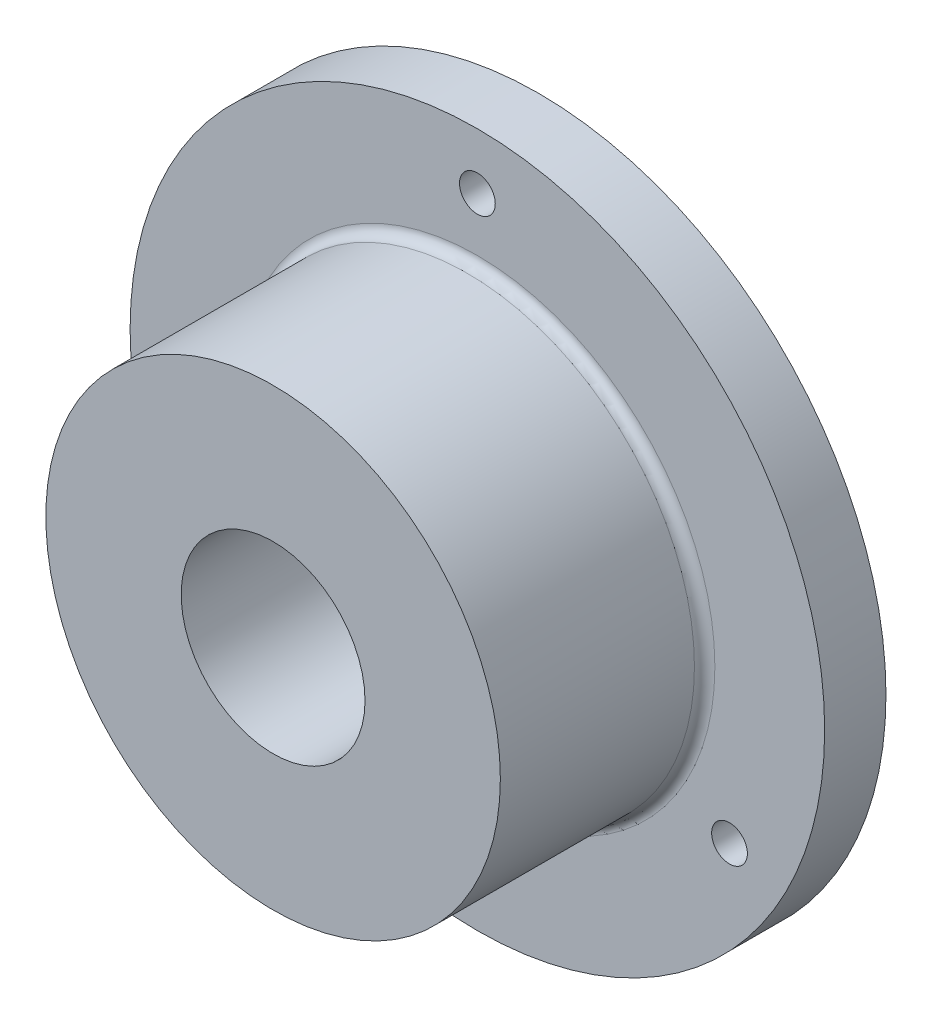
from build123d import *

# Parameters (mm, degrees)
SKETCH_1_R                 = 34
EXTRUDE_252_DEPTH          = 6
SKETCH_2_R                 = 22.25
EXTRUDE_346_DEPTH          = 20
SKETCH_4_R                 = 1.75
CUT_EXTRUDE_656_DEPTH      = 53.076866265
FILLET_1_R                 = 1
CUT_EXTRUDE_770_DEPTH      = 55.662601475
CUT_EXTRUDE_770_DEPTH_BACK = 55.662601475
SKETCH_3_R                 = 9


with BuildPart() as part:
    # 草图1 → Extrude 252 (new body)
    with BuildSketch(Plane.XY):
        Circle(SKETCH_1_R)
    extrude(amount=EXTRUDE_252_DEPTH)

    # 草图2 → Extrude 346 (add)
    with BuildSketch(Plane.XY.offset(6)):
        Circle(SKETCH_2_R)
    extrude(amount=EXTRUDE_346_DEPTH)

    # 草图4 → Cut-Extrude 656 (cut, through all)
    with BuildSketch(Plane.XY.offset(6)):
        with Locations((0, 28.5)):
            Circle(SKETCH_4_R)
        with Locations((24.681724008, -14.25)):
            Circle(SKETCH_4_R)
        with Locations((-24.681724008, -14.25)):
            Circle(SKETCH_4_R)
    extrude(amount=-CUT_EXTRUDE_656_DEPTH, mode=Mode.SUBTRACT)

    # 圆角1
    fillet_1_edges = [part.edges().sort_by_distance(p)[0] for p in [
        (-22.25, 0, 6),
    ]]
    fillet(fillet_1_edges, radius=FILLET_1_R)

    # 草图3 → Cut-Extrude 770 (cut, two sides: drawn at the far end of the back side and taken through both)
    with BuildSketch(Plane.XY.offset(26).offset(-CUT_EXTRUDE_770_DEPTH_BACK)):
        Circle(SKETCH_3_R)
    extrude(amount=CUT_EXTRUDE_770_DEPTH + CUT_EXTRUDE_770_DEPTH_BACK, mode=Mode.SUBTRACT)


solid = part.part
